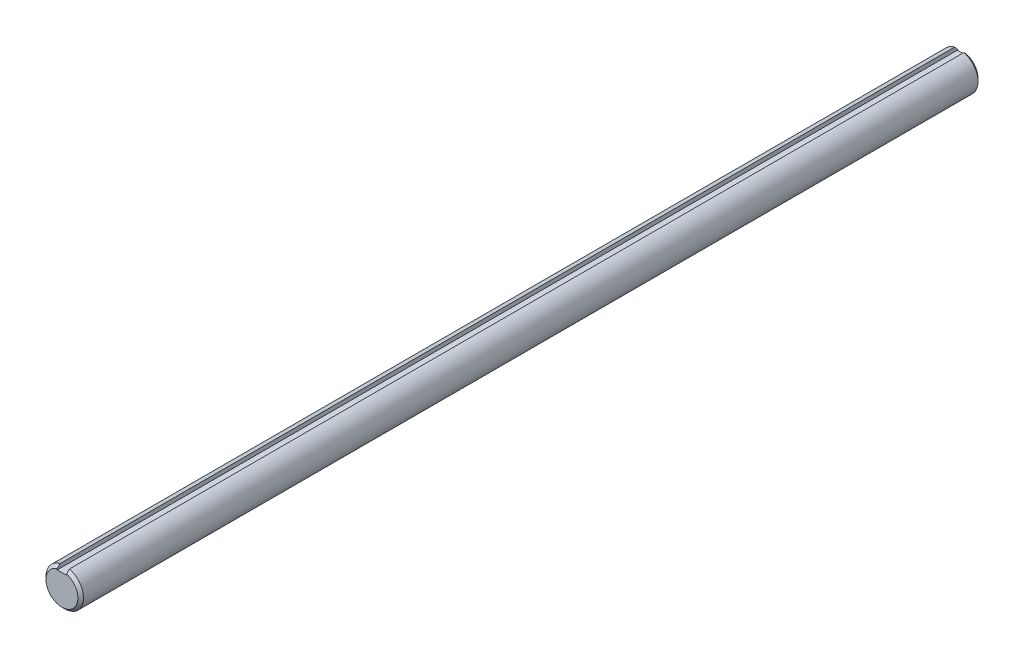
from build123d import *

# Parameters (mm, degrees)
SKETCH1_R           = 6.35
EXTRUDE1_DEPTH      = 152.4
CHAMFER1_SIZE       = 0.9525
EXTRUDE2_DEPTH      = 153.664354058
EXTRUDE2_DEPTH_BACK = 153.664354058
SKETCH3_W           = 3.175
SKETCH3_H           = 1.5875


with BuildPart() as part:
    # Sketch1 → Extrude1 (new, symmetric)
    with BuildSketch(Plane.XY):
        with Locations(Location((0, 0, 0), (0, 0, 180))):
            Circle(SKETCH1_R)
    extrude(amount=EXTRUDE1_DEPTH, both=True)

    # Chamfer1
    chamfer1_edges = [part.edges().sort_by_distance(p)[0] for p in [
        (6.35, 0, -152.4),
        (6.35, 0, 152.4),
    ]]
    chamfer(chamfer1_edges, length=CHAMFER1_SIZE)

    # Sketch3 → Extrude2 (cut, two sides: drawn at the far end of the back side and taken through both)
    with BuildSketch(Plane.XY.offset(-EXTRUDE2_DEPTH_BACK)):
        with Locations((0, 5.55625)):
            Rectangle(SKETCH3_W, SKETCH3_H)
    extrude(amount=EXTRUDE2_DEPTH + EXTRUDE2_DEPTH_BACK, mode=Mode.SUBTRACT)


solid = part.part
